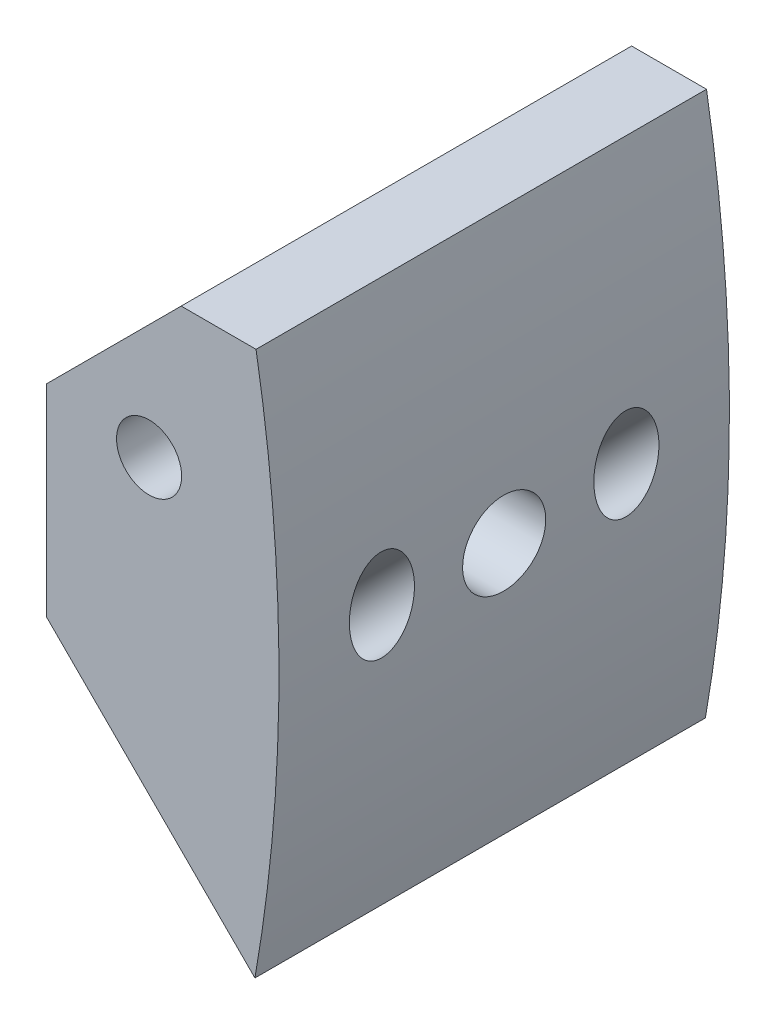
from build123d import *

# Parameters (mm, degrees)
EXTRUDE1_DEPTH            = 18.7198
SKETCH13_W                = 30.336118919
SKETCH13_H                = 26.43936277
EXTRUDE2_DEPTH            = 40.057833358
F_6_32_TAPPED_HOLE2_D     = 2.7051
EXTRUDE3_DEPTH            = 40.057833358
F_6_32_TAPPED_HOLE1_D     = 2.7051
F_8_32_TAPPED_HOLE5_D     = 3.4544
F_8_32_TAPPED_HOLE5_DEPTH = 19.05
F_8_32_TAPPED_HOLE5_TIP   = 1.037806461
SKETCH22_W                = 9.398
SKETCH22_H                = 21.690053411
EXTRUDE4_DEPTH            = 33.232321948
CHAMFER1_SIZE             = 5.588


with BuildPart() as part:
    # Sketch1 → Extrude1 (new body)
    with BuildSketch(Plane.XY):
        with BuildLine():
            Line((0, 0), (0, -13.17458008))
            Line((0, -13.17458008), (15.324208221, -28.498788301))
            ThreePointArc((15.324208221, -28.498788301), (19.05, -6.58729004), (15.324208221, 15.324208221))
            Line((15.324208221, 15.324208221), (0, 15.324208221))
            Line((0, 15.324208221), (0, 0))
        make_face()
    extrude(amount=EXTRUDE1_DEPTH)

    # Sketch13 → Extrude2 (cut, through all)
    with BuildSketch(Plane.XY.offset(18.7198)):
        with Locations((15.16805946, 17.825101305)):
            Rectangle(SKETCH13_W, SKETCH13_H)
    extrude(amount=-EXTRUDE2_DEPTH, mode=Mode.SUBTRACT)

    # #6-32 Tapped Hole2 (through all)
    with Locations(Plane.XY.offset(18.7198)):
        with Locations((13.6525, -1.50729004)):
            Hole(F_6_32_TAPPED_HOLE2_D / 2)

    # Sketch14 → Extrude3 (cut, through all)
    with BuildSketch(Plane.XY.offset(18.7198)):
        Polygon((0.684709755, -13.859289835), (7.276217748, -7.267781842), (18.052525094, -18.044089188), (21.915716214, -21.907280308), (15.324208221, -28.498788301), align=None)
    extrude(amount=-EXTRUDE3_DEPTH, mode=Mode.SUBTRACT)

    # #6-32 Tapped Hole1 (through all)
    with Locations(Plane(origin=(12.651735758, -12.643299852, 14.4399), x_dir=(-0.707106781187, 0.707106781187, 0), z_dir=(-0.707106781187, -0.707106781187, 0))):
        with Locations((0, 0), (0, 10.16)):
            Hole(F_6_32_TAPPED_HOLE1_D / 2)

    # #8-32 Tapped Hole5
    with Locations(Plane.ZY):
        with Locations((9.3599, -6.58729004)):
            Hole(F_8_32_TAPPED_HOLE5_D / 2, depth=F_8_32_TAPPED_HOLE5_DEPTH)
            with Locations((0, 0, -(F_8_32_TAPPED_HOLE5_DEPTH + F_8_32_TAPPED_HOLE5_TIP / 2))):  # 118° drill point
                Cone(0, F_8_32_TAPPED_HOLE5_D / 2, F_8_32_TAPPED_HOLE5_TIP, mode=Mode.SUBTRACT)

    # Sketch22 → Extrude4 (cut, through all)
    with BuildSketch(Plane.XY.offset(18.7198)):
        with Locations((4.699, -6.239606786)):
            Rectangle(SKETCH22_W, SKETCH22_H)
    extrude(amount=-EXTRUDE4_DEPTH, mode=Mode.SUBTRACT)

    # Chamfer1
    chamfer1_edges = [part.edges().sort_by_distance(p)[0] for p in [
        (9.398, 4.60541992, 9.3599),
    ]]
    chamfer(chamfer1_edges, length=CHAMFER1_SIZE)


solid = part.part
